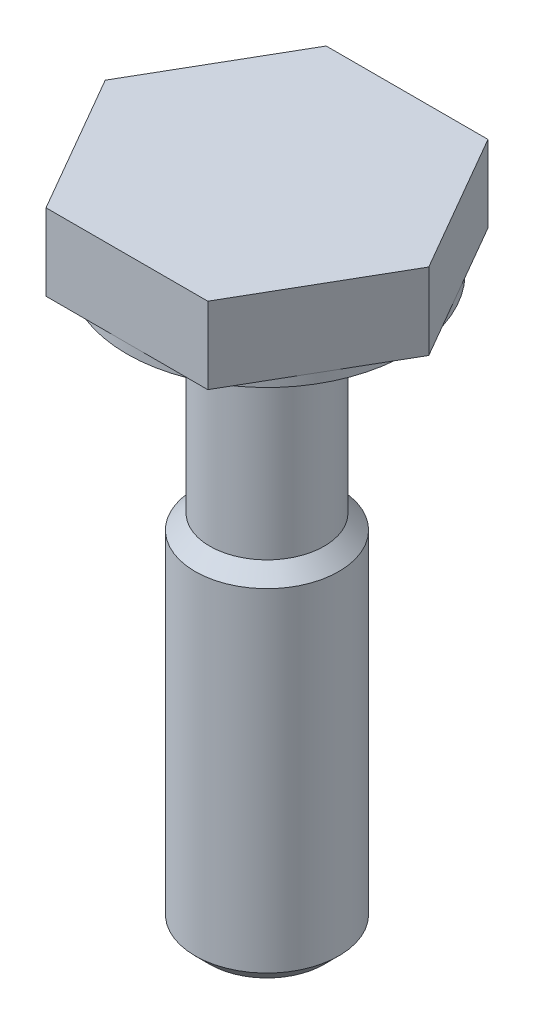
from build123d import *

# Parameters (mm, degrees)
BOSS_EXTRUDE1_DEPTH = 1.6


with BuildPart() as part:
    # Эскиз1 → Повернуть1 (revolve)
    with BuildSketch(Plane.XY, mode=Mode.PRIVATE) as revolve_1_sk:
        Polygon((-2.875, 1.8), (0, 1.8), (0, -11.24), (-0.65, -11.9), (-1.195, -11.9), (-1.5, -11.595), (-1.5, -4.645), (-1.195, -4.34), (-1.195, 1), (-2.5, 1), (-2.5, 0), (-2.925, 0), (-2.925, 1.75), align=None)
    revolve(revolve_1_sk.sketch.rotate(Axis((0, 0, 0), (0, -1, 0)), 270), axis=Axis((0, 0, 0), (0, -1, 0)))

    # Sketch1 → Boss-Extrude1 (add)
    with BuildSketch(Plane(origin=(0, 1.8, 0), x_dir=(1, 0, 0), z_dir=(0, 1, 0))):
        Polygon((1.688749537, 2.925), (-1.688749537, 2.925), (-3.377499075, 0), (-1.688749537, -2.925), (1.688749537, -2.925), (3.377499075, 0), align=None)
    extrude(amount=-BOSS_EXTRUDE1_DEPTH)


solid = part.part
